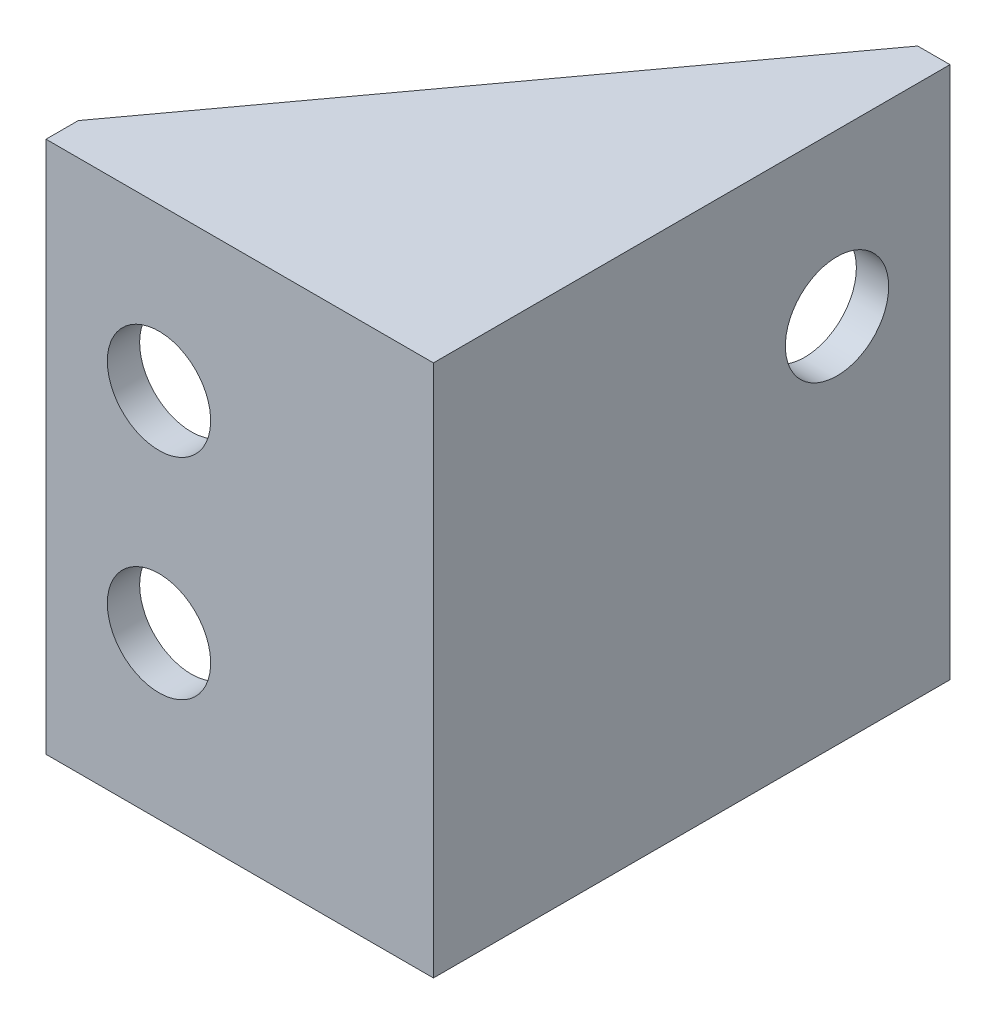
from build123d import *

# Parameters (mm, degrees)
EXTRUDE_1_DEPTH     = 16.5
SKETCH_2_R          = 1.6
CUT_EXTRUDE_1_DEPTH = 6
SKETCH_3_R          = 1.6
CUT_EXTRUDE_2_DEPTH = 10
EXTRUDE_2_DEPTH     = 1
EXTRUDE_3_DEPTH     = 1


with BuildPart() as part:
    # 草图1 → 凸台-拉伸1 (new body)
    with BuildSketch(Plane(origin=(0, 0, 0), x_dir=(1, 0, 0), z_dir=(0, 1, 0))):
        Polygon((0, 0), (12, 0), (12, 16), (11, 16), (11, 1), (0, 1), align=None)
    extrude(amount=EXTRUDE_1_DEPTH)

    # 草图2 → 切除-拉伸1 (cut)
    with BuildSketch(Plane(origin=(12, 0, 0), x_dir=(0, 0, -1), z_dir=(1, 0, 0))):
        with Locations((12.5, 11.5)):
            Circle(SKETCH_2_R)
    extrude(amount=-CUT_EXTRUDE_1_DEPTH, mode=Mode.SUBTRACT)

    # 草图3 → 切除-拉伸2 (cut)
    with BuildSketch(Plane(origin=(0, 0, -1), x_dir=(-1, 0, 0), z_dir=(0, 0, -1))):
        with Locations((-3.5, 5)):
            Circle(SKETCH_3_R)
        with Locations((-3.5, 11.5)):
            Circle(SKETCH_3_R)
    extrude(amount=-CUT_EXTRUDE_2_DEPTH, mode=Mode.SUBTRACT)

    # 草图4 → 凸台-拉伸2 (add)
    with BuildSketch(Plane.XZ):
        Polygon((0, -1), (11, -1), (11, -16), align=None)
    extrude(amount=-EXTRUDE_2_DEPTH)

    # 草图5 → 凸台-拉伸3 (add)
    with BuildSketch(Plane(origin=(0, 16.5, 0), x_dir=(1, 0, 0), z_dir=(0, 1, 0))):
        Polygon((0, 1), (11, 1), (11, 16), align=None)
    extrude(amount=-EXTRUDE_3_DEPTH)


solid = part.part
